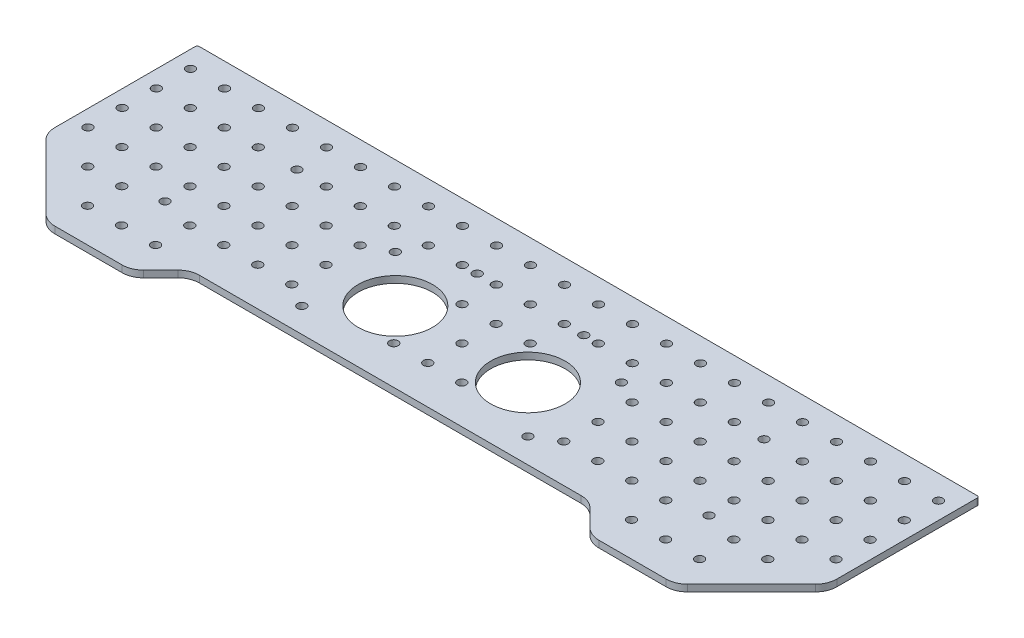
from build123d import *

# Parameters (mm, degrees)
SKETCH3_R           = 2.05
SKETCH3_R_2         = 17.5
BOSS_EXTRUDE2_DEPTH = 3.175
FILLET1_R           = 10
FILLET2_R           = 1
SKETCH6_R           = 2.05
CUT_EXTRUDE3_DEPTH  = 3.18


with BuildPart() as part:
    # Sketch3 → Boss-Extrude2 (new body)
    with BuildSketch(Plane(origin=(0, 0, 0), x_dir=(1, 0, 0), z_dir=(0, 1, 0))):
        Polygon((-184, -11.5875), (-148, -47.5875), (-108, -47.5875), (-94, -33.5875), (94, -33.5875), (108, -47.5875), (148, -47.5875), (184, -11.5875), (184, 59.5875), (-184, 59.5875), align=None)
        with Locations(Location((-128, -11.5875, 0), (0, 0, 270))):
            Circle(SKETCH3_R, mode=Mode.SUBTRACT)
        with Locations(Location((128, -11.5875, 0), (0, 0, 90))):
            Circle(SKETCH3_R, mode=Mode.SUBTRACT)
        with Locations(Location((-53.195464853, 22, 0), (0, 0, 270))):
            Circle(SKETCH3_R, mode=Mode.SUBTRACT)
        with Locations(Location((-53.195464853, -22, 0), (0, 0, 270))):
            Circle(SKETCH3_R, mode=Mode.SUBTRACT)
        with Locations(Location((53.195464853, 22, 0), (0, 0, 90))):
            Circle(SKETCH3_R, mode=Mode.SUBTRACT)
        with Locations(Location((53.195464853, -22, 0), (0, 0, 90))):
            Circle(SKETCH3_R, mode=Mode.SUBTRACT)
        with Locations(Location((-31.195464853, 0, 0), (0, 0, 270))):
            Circle(SKETCH3_R_2, mode=Mode.SUBTRACT)
        with Locations(Location((31.195464853, 0, 0), (0, 0, 90))):
            Circle(SKETCH3_R_2, mode=Mode.SUBTRACT)
    extrude(amount=BOSS_EXTRUDE2_DEPTH)

    # Fillet1
    fillet1_edges = [part.edges().sort_by_distance(p)[0] for p in [
        (184, 1.5875, 11.5875),
        (148, 1.5875, 47.5875),
        (108, 1.5875, 47.5875),
        (94, 1.5875, 33.5875),
        (-94, 1.5875, 33.5875),
        (-108, 1.5875, 47.5875),
        (-148, 1.5875, 47.5875),
        (-184, 1.5875, 11.5875),
    ]]
    fillet(fillet1_edges, radius=FILLET1_R)

    # Fillet2
    fillet2_edges = [part.edges().sort_by_distance(p)[0] for p in [
        (184, 1.5875, -59.5875),
        (-184, 1.5875, -59.5875),
    ]]
    fillet(fillet2_edges, radius=FILLET2_R)

    # Sketch6 → Cut-Extrude3 (cut)
    with BuildSketch(Plane(origin=(0, 3.175, 0), x_dir=(1, 0, 0), z_dir=(0, 1, 0))):
        with Locations(Location((-176, 48.4125, 0), (0, 0, 270))):
            Circle(SKETCH6_R)
        with Locations(Location((-160, 48.4125, 0), (0, 0, 270))):
            Circle(SKETCH6_R)
        with Locations(Location((-144, 48.4125, 0), (0, 0, 270))):
            Circle(SKETCH6_R)
        with Locations(Location((-128, 48.4125, 0), (0, 0, 270))):
            Circle(SKETCH6_R)
        with Locations(Location((-112, 48.4125, 0), (0, 0, 270))):
            Circle(SKETCH6_R)
        with Locations(Location((-96, 48.4125, 0), (0, 0, 270))):
            Circle(SKETCH6_R)
        with Locations(Location((-80, 48.4125, 0), (0, 0, 270))):
            Circle(SKETCH6_R)
        with Locations(Location((-64, 48.4125, 0), (0, 0, 270))):
            Circle(SKETCH6_R)
        with Locations(Location((-48, 48.4125, 0), (0, 0, 270))):
            Circle(SKETCH6_R)
        with Locations(Location((-32, 48.4125, 0), (0, 0, 270))):
            Circle(SKETCH6_R)
        with Locations(Location((-16, 48.4125, 0), (0, 0, 270))):
            Circle(SKETCH6_R)
        with Locations(Location((0, 48.4125, 0), (0, 0, 270))):
            Circle(SKETCH6_R)
        with Locations(Location((16, 48.4125, 0), (0, 0, 270))):
            Circle(SKETCH6_R)
        with Locations(Location((32, 48.4125, 0), (0, 0, 270))):
            Circle(SKETCH6_R)
        with Locations(Location((48, 48.4125, 0), (0, 0, 270))):
            Circle(SKETCH6_R)
        with Locations(Location((64, 48.4125, 0), (0, 0, 270))):
            Circle(SKETCH6_R)
        with Locations(Location((80, 48.4125, 0), (0, 0, 270))):
            Circle(SKETCH6_R)
        with Locations(Location((96, 48.4125, 0), (0, 0, 270))):
            Circle(SKETCH6_R)
        with Locations(Location((112, 48.4125, 0), (0, 0, 270))):
            Circle(SKETCH6_R)
        with Locations(Location((128, 48.4125, 0), (0, 0, 270))):
            Circle(SKETCH6_R)
        with Locations(Location((144, 48.4125, 0), (0, 0, 270))):
            Circle(SKETCH6_R)
        with Locations(Location((160, 48.4125, 0), (0, 0, 270))):
            Circle(SKETCH6_R)
        with Locations(Location((176, 48.4125, 0), (0, 0, 270))):
            Circle(SKETCH6_R)
        with Locations(Location((-160.086895738, 32.412735966, 0), (0, 0, 270))):
            Circle(SKETCH6_R)
        with Locations(Location((-144.086895738, 32.412735966, 0), (0, 0, 270))):
            Circle(SKETCH6_R)
        with Locations(Location((-128.086895738, 32.412735966, 0), (0, 0, 270))):
            Circle(SKETCH6_R)
        with Locations(Location((-96.086895738, 32.412735966, 0), (0, 0, 270))):
            Circle(SKETCH6_R)
        with Locations(Location((-80.086895738, 32.412735966, 0), (0, 0, 270))):
            Circle(SKETCH6_R)
        with Locations(Location((-64.086895738, 32.412735966, 0), (0, 0, 270))):
            Circle(SKETCH6_R)
        with Locations(Location((-48.086895738, 32.412735966, 0), (0, 0, 270))):
            Circle(SKETCH6_R)
        with Locations(Location((-32.086895738, 32.412735966, 0), (0, 0, 270))):
            Circle(SKETCH6_R)
        with Locations(Location((-16.086895738, 32.412735966, 0), (0, 0, 270))):
            Circle(SKETCH6_R)
        with Locations(Location((-0.086895738, 32.412735966, 0), (0, 0, 270))):
            Circle(SKETCH6_R)
        with Locations(Location((15.913104262, 32.412735966, 0), (0, 0, 270))):
            Circle(SKETCH6_R)
        with Locations(Location((31.913104262, 32.412735966, 0), (0, 0, 270))):
            Circle(SKETCH6_R)
        with Locations(Location((47.913104262, 32.412735966, 0), (0, 0, 270))):
            Circle(SKETCH6_R)
        with Locations(Location((63.913104262, 32.412735966, 0), (0, 0, 270))):
            Circle(SKETCH6_R)
        with Locations(Location((79.913104262, 32.412735966, 0), (0, 0, 270))):
            Circle(SKETCH6_R)
        with Locations(Location((95.913104262, 32.412735966, 0), (0, 0, 270))):
            Circle(SKETCH6_R)
        with Locations(Location((127.913104262, 32.412735966, 0), (0, 0, 270))):
            Circle(SKETCH6_R)
        with Locations(Location((143.913104262, 32.412735966, 0), (0, 0, 270))):
            Circle(SKETCH6_R)
        with Locations(Location((159.913104262, 32.412735966, 0), (0, 0, 270))):
            Circle(SKETCH6_R)
        with Locations(Location((175.913104262, 32.412735966, 0), (0, 0, 270))):
            Circle(SKETCH6_R)
        with Locations(Location((-160.173791475, 16.412971933, 0), (0, 0, 270))):
            Circle(SKETCH6_R)
        with Locations(Location((-144.173791475, 16.412971933, 0), (0, 0, 270))):
            Circle(SKETCH6_R)
        with Locations(Location((-128.173791475, 16.412971933, 0), (0, 0, 270))):
            Circle(SKETCH6_R)
        with Locations(Location((-112.173791475, 16.412971933, 0), (0, 0, 270))):
            Circle(SKETCH6_R)
        with Locations(Location((-96.173791475, 16.412971933, 0), (0, 0, 270))):
            Circle(SKETCH6_R)
        with Locations(Location((-80.173791475, 16.412971933, 0), (0, 0, 270))):
            Circle(SKETCH6_R)
        with Locations(Location((-64.173791475, 16.412971933, 0), (0, 0, 270))):
            Circle(SKETCH6_R)
        with Locations(Location((-16.173791475, 16.412971933, 0), (0, 0, 270))):
            Circle(SKETCH6_R)
        with Locations(Location((-0.173791475, 16.412971933, 0), (0, 0, 270))):
            Circle(SKETCH6_R)
        with Locations(Location((15.826208525, 16.412971933, 0), (0, 0, 270))):
            Circle(SKETCH6_R)
        with Locations(Location((63.826208525, 16.412971933, 0), (0, 0, 270))):
            Circle(SKETCH6_R)
        with Locations(Location((79.826208525, 16.412971933, 0), (0, 0, 270))):
            Circle(SKETCH6_R)
        with Locations(Location((95.826208525, 16.412971933, 0), (0, 0, 270))):
            Circle(SKETCH6_R)
        with Locations(Location((111.826208525, 16.412971933, 0), (0, 0, 270))):
            Circle(SKETCH6_R)
        with Locations(Location((127.826208525, 16.412971933, 0), (0, 0, 270))):
            Circle(SKETCH6_R)
        with Locations(Location((143.826208525, 16.412971933, 0), (0, 0, 270))):
            Circle(SKETCH6_R)
        with Locations(Location((159.826208525, 16.412971933, 0), (0, 0, 270))):
            Circle(SKETCH6_R)
        with Locations(Location((175.826208525, 16.412971933, 0), (0, 0, 270))):
            Circle(SKETCH6_R)
        with Locations(Location((-160.260687213, 0.413207899, 0), (0, 0, 270))):
            Circle(SKETCH6_R)
        with Locations(Location((-144.260687213, 0.413207899, 0), (0, 0, 270))):
            Circle(SKETCH6_R)
        with Locations(Location((-128.260687213, 0.413207899, 0), (0, 0, 270))):
            Circle(SKETCH6_R)
        with Locations(Location((-112.260687213, 0.413207899, 0), (0, 0, 270))):
            Circle(SKETCH6_R)
        with Locations(Location((-96.260687213, 0.413207899, 0), (0, 0, 270))):
            Circle(SKETCH6_R)
        with Locations(Location((-80.260687213, 0.413207899, 0), (0, 0, 270))):
            Circle(SKETCH6_R)
        with Locations(Location((-64.260687213, 0.413207899, 0), (0, 0, 270))):
            Circle(SKETCH6_R)
        with Locations(Location((-0.260687213, 0.413207899, 0), (0, 0, 270))):
            Circle(SKETCH6_R)
        with Locations(Location((63.739312787, 0.413207899, 0), (0, 0, 270))):
            Circle(SKETCH6_R)
        with Locations(Location((79.739312787, 0.413207899, 0), (0, 0, 270))):
            Circle(SKETCH6_R)
        with Locations(Location((95.739312787, 0.413207899, 0), (0, 0, 270))):
            Circle(SKETCH6_R)
        with Locations(Location((111.739312787, 0.413207899, 0), (0, 0, 270))):
            Circle(SKETCH6_R)
        with Locations(Location((127.739312787, 0.413207899, 0), (0, 0, 270))):
            Circle(SKETCH6_R)
        with Locations(Location((143.739312787, 0.413207899, 0), (0, 0, 270))):
            Circle(SKETCH6_R)
        with Locations(Location((159.739312787, 0.413207899, 0), (0, 0, 270))):
            Circle(SKETCH6_R)
        with Locations(Location((175.739312787, 0.413207899, 0), (0, 0, 270))):
            Circle(SKETCH6_R)
        with Locations(Location((-160.34758295, -15.586556134, 0), (0, 0, 270))):
            Circle(SKETCH6_R)
        with Locations(Location((-144.34758295, -15.586556134, 0), (0, 0, 270))):
            Circle(SKETCH6_R)
        with Locations(Location((-112.34758295, -15.586556134, 0), (0, 0, 270))):
            Circle(SKETCH6_R)
        with Locations(Location((-96.34758295, -15.586556134, 0), (0, 0, 270))):
            Circle(SKETCH6_R)
        with Locations(Location((-80.34758295, -15.586556134, 0), (0, 0, 270))):
            Circle(SKETCH6_R)
        with Locations(Location((-64.34758295, -15.586556134, 0), (0, 0, 270))):
            Circle(SKETCH6_R)
        with Locations(Location((-16.34758295, -15.586556134, 0), (0, 0, 270))):
            Circle(SKETCH6_R)
        with Locations(Location((-0.34758295, -15.586556134, 0), (0, 0, 270))):
            Circle(SKETCH6_R)
        with Locations(Location((15.65241705, -15.586556134, 0), (0, 0, 270))):
            Circle(SKETCH6_R)
        with Locations(Location((63.65241705, -15.586556134, 0), (0, 0, 270))):
            Circle(SKETCH6_R)
        with Locations(Location((79.65241705, -15.586556134, 0), (0, 0, 270))):
            Circle(SKETCH6_R)
        with Locations(Location((95.65241705, -15.586556134, 0), (0, 0, 270))):
            Circle(SKETCH6_R)
        with Locations(Location((111.65241705, -15.586556134, 0), (0, 0, 270))):
            Circle(SKETCH6_R)
        with Locations(Location((143.65241705, -15.586556134, 0), (0, 0, 270))):
            Circle(SKETCH6_R)
        with Locations(Location((159.65241705, -15.586556134, 0), (0, 0, 270))):
            Circle(SKETCH6_R)
        with Locations(Location((-144.434478688, -31.586320168, 0), (0, 0, 270))):
            Circle(SKETCH6_R)
        with Locations(Location((-128.434478688, -31.586320168, 0), (0, 0, 270))):
            Circle(SKETCH6_R)
        with Locations(Location((-112.434478688, -31.586320168, 0), (0, 0, 270))):
            Circle(SKETCH6_R)
        with Locations(Location((111.565521312, -31.586320168, 0), (0, 0, 270))):
            Circle(SKETCH6_R)
        with Locations(Location((127.565521312, -31.586320168, 0), (0, 0, 270))):
            Circle(SKETCH6_R)
        with Locations(Location((143.565521312, -31.586320168, 0), (0, 0, 270))):
            Circle(SKETCH6_R)
        with Locations(Location((-176.086895738, 32.412735966, 0), (0, 0, 270))):
            Circle(SKETCH6_R)
        with Locations(Location((-176.173791475, 16.412971933, 0), (0, 0, 270))):
            Circle(SKETCH6_R)
        with Locations(Location((-176.260687213, 0.413207899, 0), (0, 0, 270))):
            Circle(SKETCH6_R)
        with Locations(Location((-25.086895738, 32.412735966, 0), (0, 0, 270))):
            Circle(SKETCH6_R)
        with Locations(Location((25.086895738, 32.412735966, 0), (0, 0, 270))):
            Circle(SKETCH6_R)
        with Locations(Location((109.913104262, 32.412735966, 0), (0, 0, 270))):
            Circle(SKETCH6_R)
        with Locations(Location((-109.913104262, 32.412735966, 0), (0, 0, 270))):
            Circle(SKETCH6_R)
    extrude(amount=-CUT_EXTRUDE3_DEPTH, mode=Mode.SUBTRACT)


solid = part.part
